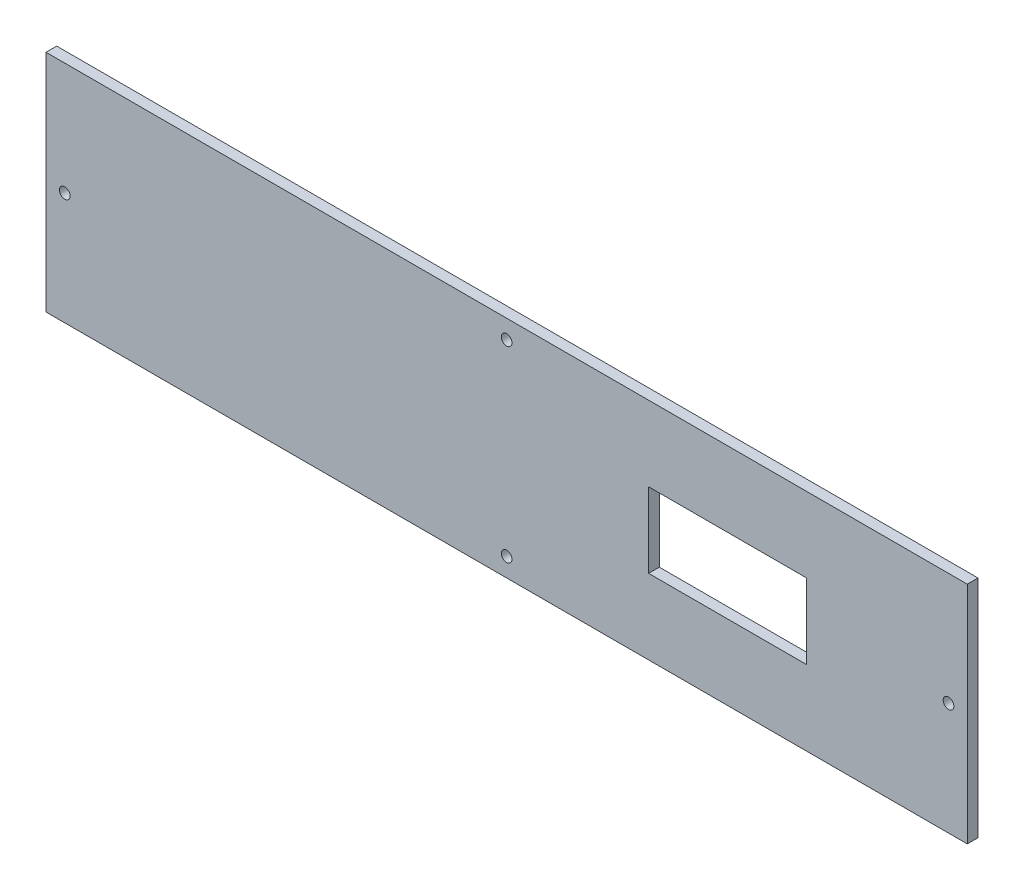
from build123d import *

# Parameters (mm, degrees)
SCHIZZO1_W                   = 344
SCHIZZO1_H                   = 84
SCHIZZO1_R                   = 2
SCHIZZO1_W_2                 = 59
SCHIZZO1_H_2                 = 28
ESTRUSIONE_ESTRUSIONE1_DEPTH = 4


with BuildPart() as part:
    # Schizzo1 → Estrusione-Estrusione1 (new body)
    with BuildSketch(Plane.XY):
        with Locations((172, 42)):
            Rectangle(SCHIZZO1_W, SCHIZZO1_H)
        with Locations((7, 42)):
            Circle(SCHIZZO1_R, mode=Mode.SUBTRACT)
        with Locations((172, 77)):
            Circle(SCHIZZO1_R, mode=Mode.SUBTRACT)
        with Locations((172, 7)):
            Circle(SCHIZZO1_R, mode=Mode.SUBTRACT)
        with Locations((337, 42)):
            Circle(SCHIZZO1_R, mode=Mode.SUBTRACT)
        with Locations((254.5, 42)):
            Rectangle(SCHIZZO1_W_2, SCHIZZO1_H_2, mode=Mode.SUBTRACT)
    extrude(amount=ESTRUSIONE_ESTRUSIONE1_DEPTH)


solid = part.part
